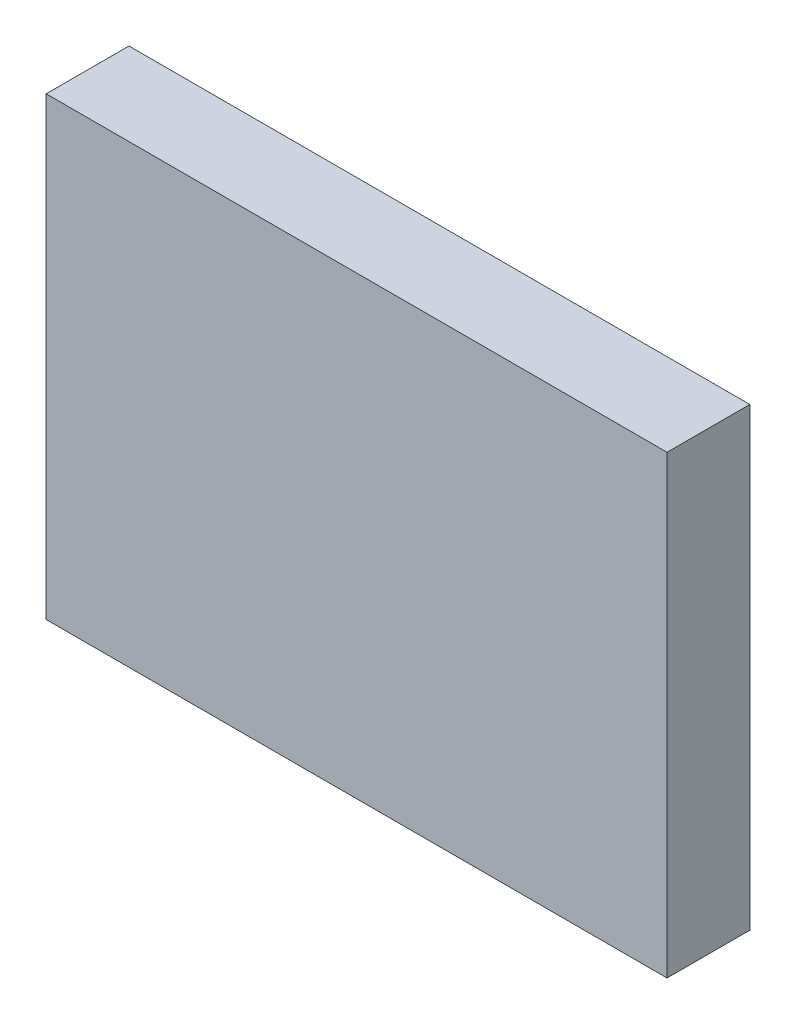
from build123d import *

# Parameters (mm, degrees)
SKETCH_1_W      = 75
SKETCH_1_H      = 55
EXTRUDE_1_DEPTH = 10


with BuildPart() as part:
    # 草图1 → 凸台-拉伸1 (new body)
    with BuildSketch(Plane.XY):
        with Locations((37.5, 27.5)):
            Rectangle(SKETCH_1_W, SKETCH_1_H)
    extrude(amount=EXTRUDE_1_DEPTH)


solid = part.part
